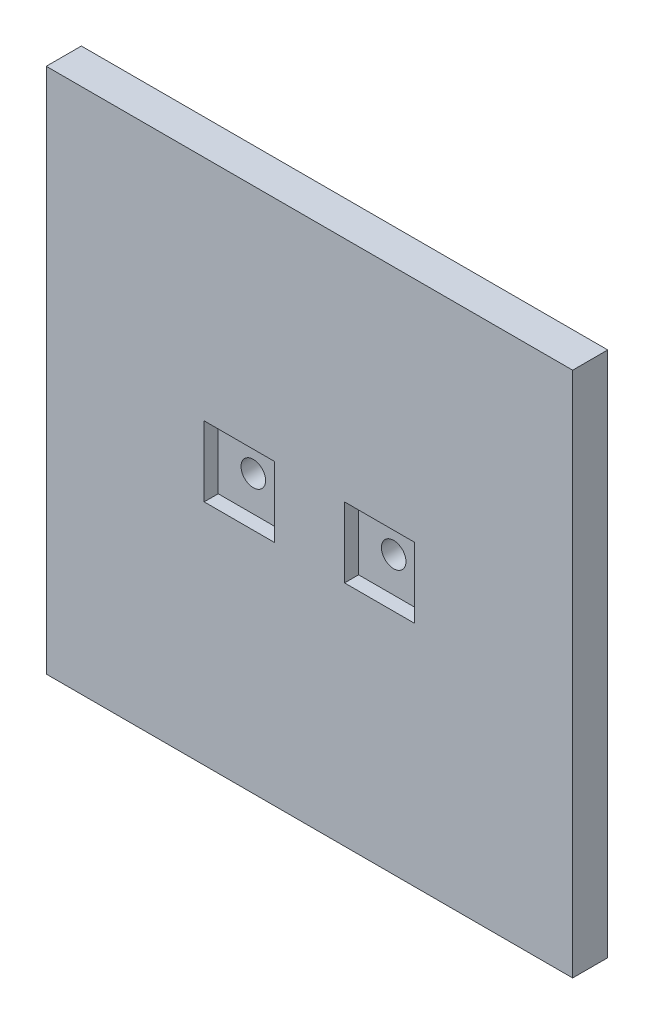
from build123d import *

# Parameters (mm, degrees)
SKETCH_1_W      = 75
SKETCH_1_H      = 75
SKETCH_1_W_2    = 10
SKETCH_1_H_2    = 10
EXTRUDE_1_DEPTH = 5
SKETCH_1_8_W    = 10
SKETCH_1_8_H    = 10
SKETCH_1_8_R    = 1.75
EXTRUDE_2_DEPTH = 3


with BuildPart() as part:
    # 草图1 → 凸台-拉伸1 (new body)
    with BuildSketch(Plane.XY):
        Rectangle(SKETCH_1_W, SKETCH_1_H)
        with Locations((-10, 0)):
            Rectangle(SKETCH_1_W_2, SKETCH_1_H_2, mode=Mode.SUBTRACT)
        with Locations((10, 0)):
            Rectangle(SKETCH_1_W_2, SKETCH_1_H_2, mode=Mode.SUBTRACT)
    extrude(amount=EXTRUDE_1_DEPTH)

    # 草图1<8> → 凸台-拉伸2 (add)
    # profile 1 of 2: a face of its own
    with BuildSketch(Plane.XY):
        with Locations((-10, 0)):
            Rectangle(SKETCH_1_8_W, SKETCH_1_8_H)
        with Locations((-10, 0)):
            Circle(SKETCH_1_8_R, mode=Mode.SUBTRACT)
    # profile 2 of 2: a face of its own
    with BuildSketch(Plane.XY):
        with Locations((10, 0)):
            Rectangle(SKETCH_1_8_W, SKETCH_1_8_H)
        with Locations((10, 0)):
            Circle(SKETCH_1_8_R, mode=Mode.SUBTRACT)
    extrude(amount=EXTRUDE_2_DEPTH)


solid = part.part
